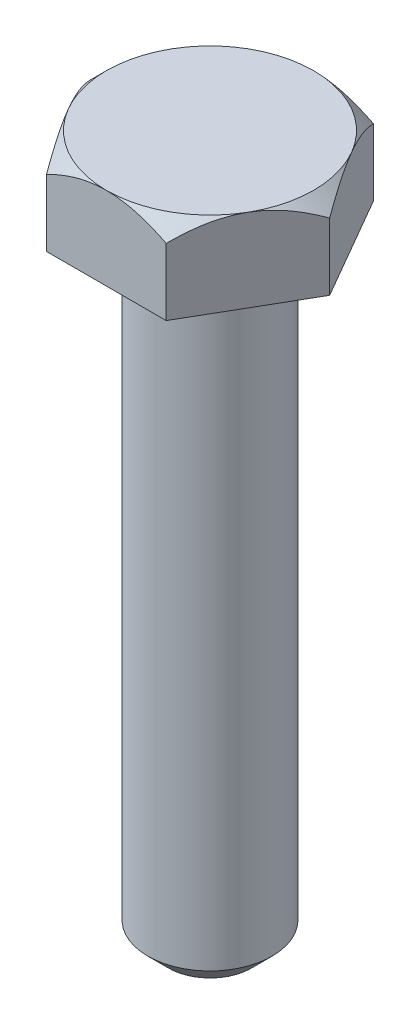
from build123d import *

# Parameters (mm, degrees)
SZKIC1_R                    = 3
DODANIE_WYCI_GNI_CIE1_DEPTH = 30
DODANIE_WYCI_GNI_CIE2_DEPTH = 4
SFAZOWANIE1_SIZE            = 1


with BuildPart() as part:
    # Szkic1 → Dodanie-wyciągnięcie1 (new body)
    with BuildSketch(Plane(origin=(0, 0, 0), x_dir=(1, 0, 0), z_dir=(0, 1, 0))):
        with Locations(Location((0, 0, 0), (0, 0, 270))):
            Circle(SZKIC1_R)
    extrude(amount=-DODANIE_WYCI_GNI_CIE1_DEPTH)

    # Szkic2 → Dodanie-wyciągnięcie2 (add)
    with BuildSketch(Plane(origin=(0, 0, 0), x_dir=(1, 0, 0), z_dir=(0, 1, 0))):
        Polygon((5.773502692, 0), (2.886751346, 5), (-2.886751346, 5), (-5.773502692, 0), (-2.886751346, -5), (2.886751346, -5), align=None)
    extrude(amount=DODANIE_WYCI_GNI_CIE2_DEPTH)

    # Szkic4 → Wycięcie-obrót1 (revolve, cut)
    with BuildSketch(Plane.XY):
        Polygon((5.773502692, 3.226497308), (5, 4), (5.773502692, 4), align=None)
    revolve(axis=Axis((0, 4, 0), (0, -1, 0)), mode=Mode.SUBTRACT)

    # Sfazowanie1
    sfazowanie1_edges = [part.edges().sort_by_distance(p)[0] for p in [
        (0, -30, -3),
    ]]
    chamfer(sfazowanie1_edges, length=SFAZOWANIE1_SIZE)


solid = part.part
